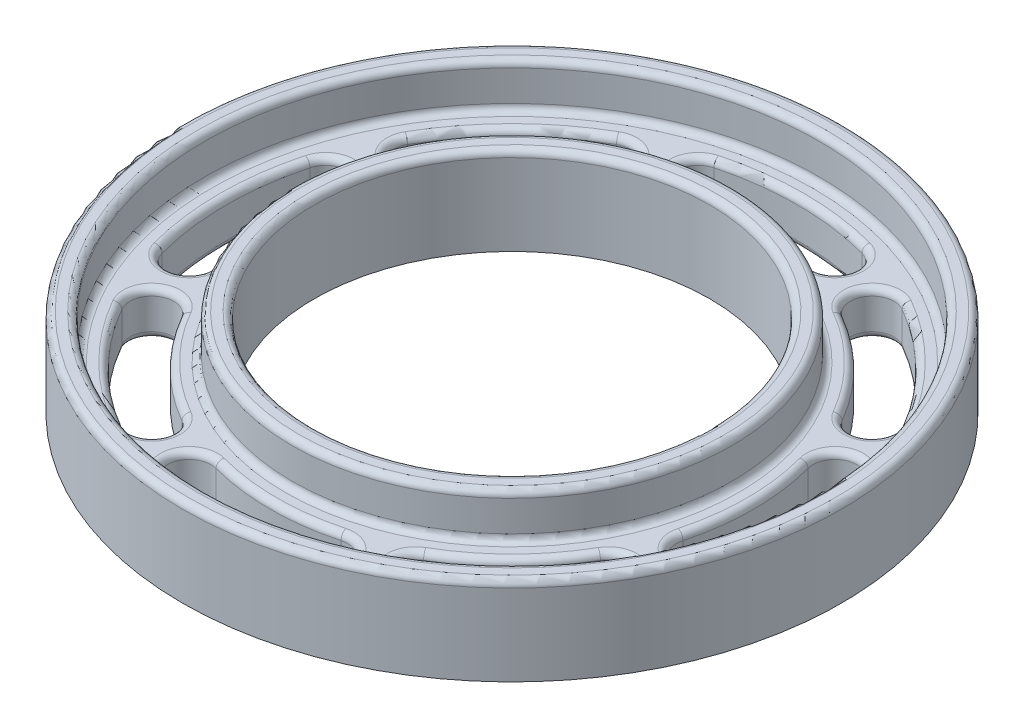
from build123d import *

# Parameters (mm, degrees)
SKETCH1_R                = 75
SKETCH1_R_2              = 45
BOSS_EXTRUDE1_DEPTH      = 10
SKETCH2_R                = 75
SKETCH2_R_2              = 70
SKETCH2_R_3              = 50
SKETCH2_R_4              = 45
BOSS_EXTRUDE2_DEPTH      = 10
FILLET1_R                = 1.5
CUT_EXTRUDE1_DEPTH       = 107.536378834
FILLET2_R                = 1.5
CIRPATTERN5_COUNT        = 8
FILLET2_OF_CIRPATTERN5_R = 1.5


with BuildPart() as part:
    # Sketch1 → Boss-Extrude1 (new body)
    with BuildSketch(Plane(origin=(0, 0, 0), x_dir=(1, 0, 0), z_dir=(0, 1, 0))):
        with Locations(Location((0, 0, 0), (0, 0, 270))):
            Circle(SKETCH1_R)
        with Locations(Location((0, 0, 0), (0, 0, 270))):
            Circle(SKETCH1_R_2, mode=Mode.SUBTRACT)
    extrude(amount=BOSS_EXTRUDE1_DEPTH)

    # Sketch2 → Boss-Extrude2 (add)
    # profile 1 of 2: a face of its own
    with BuildSketch(Plane(origin=(0, 10, 0), x_dir=(1, 0, 0), z_dir=(0, 1, 0))):
        with Locations(Location((0, 0, 0), (0, 0, 270))):
            Circle(SKETCH2_R)
        with Locations(Location((0, 0, 0), (0, 0, 270))):
            Circle(SKETCH2_R_2, mode=Mode.SUBTRACT)
    # profile 2 of 2: a face of its own
    with BuildSketch(Plane(origin=(0, 10, 0), x_dir=(1, 0, 0), z_dir=(0, 1, 0))):
        with Locations(Location((0, 0, 0), (0, 0, 270))):
            Circle(SKETCH2_R_3)
        with Locations(Location((0, 0, 0), (0, 0, 270))):
            Circle(SKETCH2_R_4, mode=Mode.SUBTRACT)
    extrude(amount=BOSS_EXTRUDE2_DEPTH)

    # Fillet1
    fillet1_edges = [part.edges().sort_by_distance(p)[0] for p in [
        (0, 10, -70),
        (0, 20, -70),
        (0, 20, -75),
        (0, 10, -50),
        (0, 20, -45),
        (0, 20, -50),
    ]]
    fillet(fillet1_edges, radius=FILLET1_R)

    # Sketch3 → Cut-Extrude1 (cut, through all)
    with BuildSketch(Plane(origin=(0, 10, 0), x_dir=(1, 0, 0), z_dir=(0, 1, 0))):
        with BuildLine():
            ThreePointArc((16.823237932, 62.785178709), (0, 65), (-16.823237932, 62.785178709))
            ThreePointArc((-16.823237932, 62.785178709), (-20.358771838, 56.661454352), (-14.235047481, 53.125920446))
            ThreePointArc((-14.235047481, 53.125920446), (0, 55), (14.235047481, 53.125920446))
            ThreePointArc((14.235047481, 53.125920446), (20.358771838, 56.661454352), (16.823237932, 62.785178709))
        make_face()
    cut_extrude1 = extrude(amount=-CUT_EXTRUDE1_DEPTH, mode=Mode.SUBTRACT)

    # Fillet2
    fillet2_edges = [part.edges().sort_by_distance(p)[0] for p in [
        (20.358771838, 0, -56.661454352),
        (0, 0, -55),
        (-20.358771838, 0, -56.661454352),
        (0, 0, -65),
        (20.358771838, 10, -56.661454352),
        (0, 10, -65),
        (-20.358771838, 10, -56.661454352),
        (0, 10, -55),
    ]]
    fillet(fillet2_edges, radius=FILLET2_R)

    # CirPattern5: Cut-Extrude1 ×8 about axis
    cirpattern5_axis = Axis((0, 0, 0), (0, 1, 0))
    for i in range(1, CIRPATTERN5_COUNT):
        add(cut_extrude1.rotate(cirpattern5_axis, i * 360 / CIRPATTERN5_COUNT), mode=Mode.SUBTRACT)

    # Fillet2 of CirPattern5
    fillet2_of_cirpattern5_edges = [part.edges().sort_by_distance(p)[0] for p in [
        (-25.669872981, 0, -54.461524227),
        (-38.890872965, 0, -38.890872965),
        (-54.461524227, 0, -25.669872981),
        (-45.961940777, 0, -45.961940777),
        (-25.669872981, 10, -54.461524227),
        (-45.961940777, 10, -45.961940777),
        (-54.461524227, 10, -25.669872981),
        (-38.890872965, 10, -38.890872965),
        (-56.661454352, 0, -20.358771838),
        (-55, 0, 0),
        (-56.661454352, 0, 20.358771838),
        (-65, 0, 0),
        (-56.661454352, 10, -20.358771838),
        (-65, 10, 0),
        (-56.661454352, 10, 20.358771838),
        (-55, 10, 0),
        (-54.461524227, 0, 25.669872981),
        (-38.890872965, 0, 38.890872965),
        (-25.669872981, 0, 54.461524227),
        (-45.961940777, 0, 45.961940777),
        (-54.461524227, 10, 25.669872981),
        (-45.961940777, 10, 45.961940777),
        (-25.669872981, 10, 54.461524227),
        (-38.890872965, 10, 38.890872965),
        (-20.358771838, 0, 56.661454352),
        (0, 0, 55),
        (20.358771838, 0, 56.661454352),
        (0, 0, 65),
        (-20.358771838, 10, 56.661454352),
        (0, 10, 65),
        (20.358771838, 10, 56.661454352),
        (0, 10, 55),
        (25.669872981, 0, 54.461524227),
        (38.890872965, 0, 38.890872965),
        (54.461524227, 0, 25.669872981),
        (45.961940777, 0, 45.961940777),
        (25.669872981, 10, 54.461524227),
        (45.961940777, 10, 45.961940777),
        (54.461524227, 10, 25.669872981),
        (38.890872965, 10, 38.890872965),
        (56.661454352, 0, 20.358771838),
        (55, 0, 0),
        (56.661454352, 0, -20.358771838),
        (65, 0, 0),
        (56.661454352, 10, 20.358771838),
        (65, 10, 0),
        (56.661454352, 10, -20.358771838),
        (55, 10, 0),
        (54.461524227, 0, -25.669872981),
        (38.890872965, 0, -38.890872965),
        (25.669872981, 0, -54.461524227),
        (45.961940777, 0, -45.961940777),
        (54.461524227, 10, -25.669872981),
        (45.961940777, 10, -45.961940777),
        (25.669872981, 10, -54.461524227),
        (38.890872965, 10, -38.890872965),
    ]]
    fillet(fillet2_of_cirpattern5_edges, radius=FILLET2_OF_CIRPATTERN5_R)


solid = part.part
